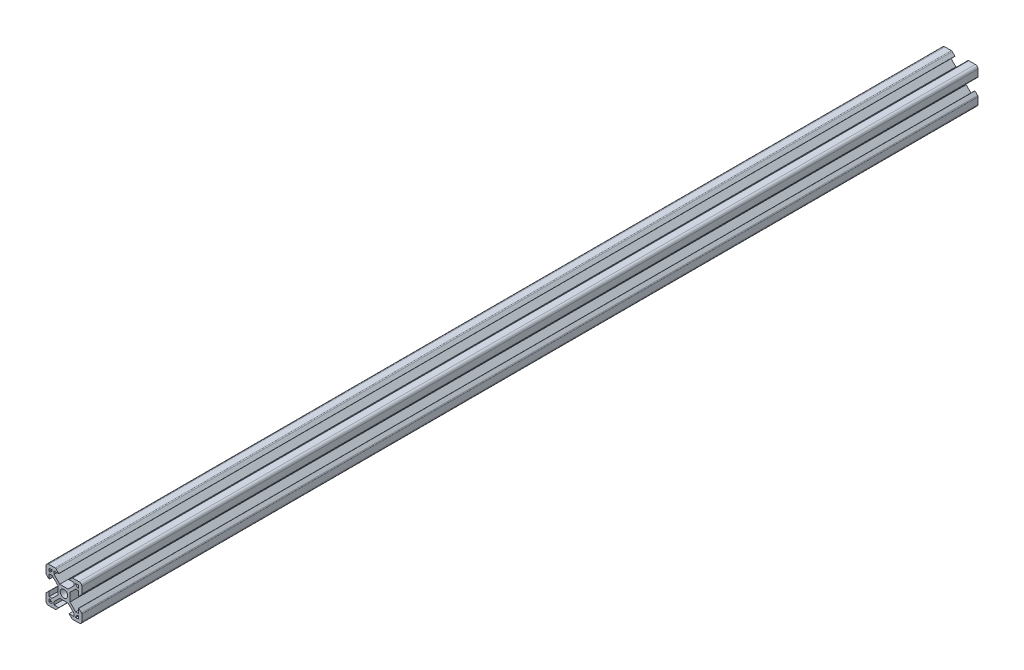
from build123d import *

# Parameters (mm, degrees)
SKETCH6_R           = 2.1
BOSS_EXTRUDE1_DEPTH = 500


with BuildPart() as part:
    # Sketch6 → Boss-Extrude1 (new body)
    with BuildSketch(Plane.XY):
        with BuildLine():
            Line((-3.4, -2.339339828), (-3.4, 2.339339828))
            Line((-3.4, 2.339339828), (-6.560660172, 5.5))
            Line((-6.560660172, 5.5), (-8.2, 5.5))
            Line((-8.2, 5.5), (-8.2, 2.89))
            Line((-8.2, 2.89), (-8.31, 2.89))
            Line((-8.31, 2.89), (-9.768614357, 4.348614357))
            ThreePointArc((-9.768614357, 4.348614357), (-9.939864831, 4.604908803), (-10, 4.907228714))
            Line((-10, 4.907228714), (-10, 8.5))
            ThreePointArc((-10, 8.5), (-9.560660172, 9.560660172), (-8.5, 10))
            Line((-8.5, 10), (-4.907228714, 10))
            ThreePointArc((-4.907228714, 10), (-4.604908803, 9.939864831), (-4.348614357, 9.768614357))
            Line((-4.348614357, 9.768614357), (-2.89, 8.31))
            Line((-2.89, 8.31), (-2.89, 8.2))
            Line((-2.89, 8.2), (-5.5, 8.2))
            Line((-5.5, 8.2), (-5.5, 6.560660172))
            Line((-5.5, 6.560660172), (-2.339339828, 3.4))
            Line((-2.339339828, 3.4), (2.339339828, 3.4))
            Line((2.339339828, 3.4), (5.5, 6.560660172))
            Line((5.5, 6.560660172), (5.5, 8.2))
            Line((5.5, 8.2), (2.89, 8.2))
            Line((2.89, 8.2), (2.89, 8.31))
            Line((2.89, 8.31), (4.348614357, 9.768614357))
            ThreePointArc((4.348614357, 9.768614357), (4.604908803, 9.939864831), (4.907228714, 10))
            Line((4.907228714, 10), (8.5, 10))
            ThreePointArc((8.5, 10), (9.560660172, 9.560660172), (10, 8.5))
            Line((10, 8.5), (10, 4.907228714))
            ThreePointArc((10, 4.907228714), (9.939864831, 4.604908803), (9.768614357, 4.348614357))
            Line((9.768614357, 4.348614357), (8.31, 2.89))
            Line((8.31, 2.89), (8.2, 2.89))
            Line((8.2, 2.89), (8.2, 5.5))
            Line((8.2, 5.5), (6.560660172, 5.5))
            Line((6.560660172, 5.5), (3.4, 2.339339828))
            Line((3.4, 2.339339828), (3.4, -2.339339828))
            Line((3.4, -2.339339828), (6.560660172, -5.5))
            Line((6.560660172, -5.5), (8.2, -5.5))
            Line((8.2, -5.5), (8.2, -2.89))
            Line((8.2, -2.89), (8.31, -2.89))
            Line((8.31, -2.89), (9.768614357, -4.348614357))
            ThreePointArc((9.768614357, -4.348614357), (9.939864831, -4.604908803), (10, -4.907228714))
            Line((10, -4.907228714), (10, -8.5))
            ThreePointArc((10, -8.5), (9.560660172, -9.560660172), (8.5, -10))
            Line((8.5, -10), (4.907228714, -10))
            ThreePointArc((4.907228714, -10), (4.604908803, -9.939864831), (4.348614357, -9.768614357))
            Line((4.348614357, -9.768614357), (2.89, -8.31))
            Line((2.89, -8.31), (2.89, -8.2))
            Line((2.89, -8.2), (5.5, -8.2))
            Line((5.5, -8.2), (5.5, -6.560660172))
            Line((5.5, -6.560660172), (2.339339828, -3.4))
            Line((2.339339828, -3.4), (-2.339339828, -3.4))
            Line((-2.339339828, -3.4), (-5.5, -6.560660172))
            Line((-5.5, -6.560660172), (-5.5, -8.2))
            Line((-5.5, -8.2), (-2.89, -8.2))
            Line((-2.89, -8.2), (-2.89, -8.31))
            Line((-2.89, -8.31), (-4.348614357, -9.768614357))
            ThreePointArc((-4.348614357, -9.768614357), (-4.604908803, -9.939864831), (-4.907228714, -10))
            Line((-4.907228714, -10), (-8.5, -10))
            ThreePointArc((-8.5, -10), (-9.560660172, -9.560660172), (-10, -8.5))
            Line((-10, -8.5), (-10, -4.907228714))
            ThreePointArc((-10, -4.907228714), (-9.939864831, -4.604908803), (-9.768614357, -4.348614357))
            Line((-9.768614357, -4.348614357), (-8.31, -2.89))
            Line((-8.31, -2.89), (-8.2, -2.89))
            Line((-8.2, -2.89), (-8.2, -5.5))
            Line((-8.2, -5.5), (-6.560660172, -5.5))
            Line((-6.560660172, -5.5), (-3.4, -2.339339828))
        make_face()
        Circle(SKETCH6_R, mode=Mode.SUBTRACT)
        Polygon((-7.66, 6.57), (-6.57, 7.66), (-6.57, 8.2), (-8.2, 8.2), (-8.2, 6.57), align=None, mode=Mode.SUBTRACT)
        Polygon((8.2, 6.57), (7.66, 6.57), (6.57, 7.66), (6.57, 8.2), (8.2, 8.2), align=None, mode=Mode.SUBTRACT)
        Polygon((7.66, -6.57), (6.57, -7.66), (6.57, -8.2), (8.2, -8.2), (8.2, -6.57), align=None, mode=Mode.SUBTRACT)
        Polygon((-8.2, -6.57), (-7.66, -6.57), (-6.57, -7.66), (-6.57, -8.2), (-8.2, -8.2), align=None, mode=Mode.SUBTRACT)
    extrude(amount=-BOSS_EXTRUDE1_DEPTH)


solid = part.part
